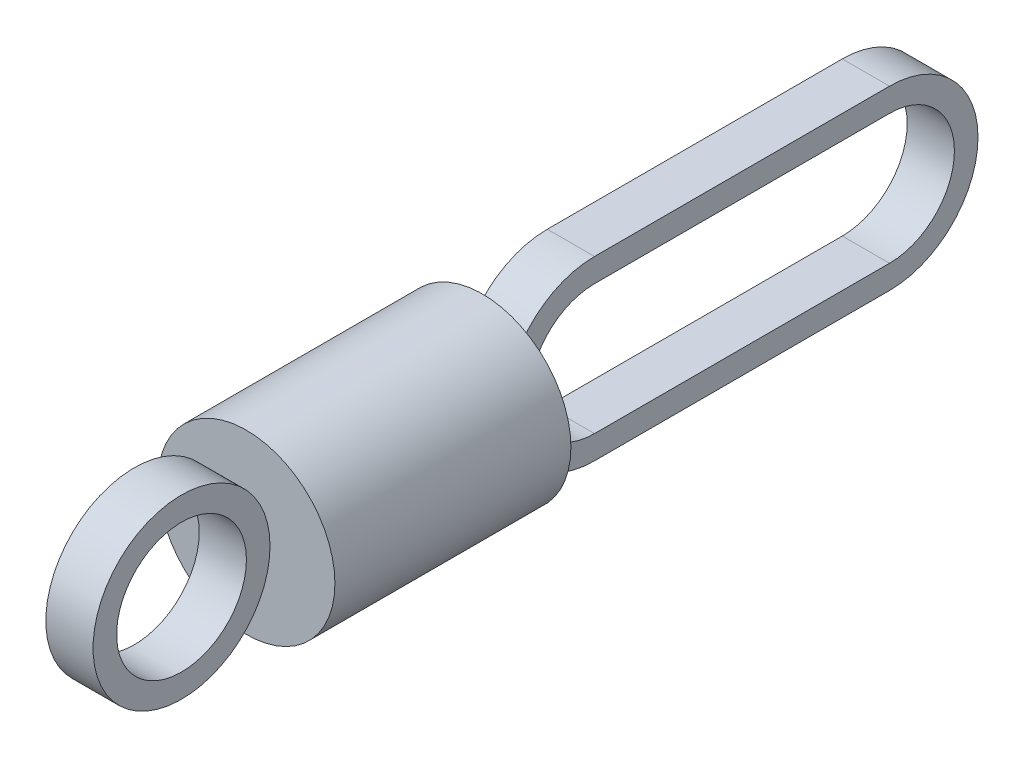
from build123d import *

# Parameters (mm, degrees)
BOSS_EXTRUDE1_DEPTH        = 0.8
BOSS_EXTRUDE1_DEPTH_BACK   = 0.8
SKETCH1_R                  = 3
BOSS_EXTRUDE1_2_DEPTH      = 0.8
BOSS_EXTRUDE1_2_DEPTH_BACK = 0.8
SKETCH2_R                  = 2.2
CUT_EXTRUDE1_DEPTH         = 1.6
SKETCH6_R                  = 3
BOSS_EXTRUDE3_DEPTH        = 8


with BuildPart() as part:
    # Sketch1 → Boss-Extrude1 (new, two sides: drawn at the far end of the back side and taken through both)
    with BuildSketch(Plane(origin=(0, 0, 0), x_dir=(0, 0, -1), z_dir=(1, 0, 0)).offset(-BOSS_EXTRUDE1_DEPTH_BACK)):
        Circle(SKETCH1_R)
    extrude(amount=BOSS_EXTRUDE1_DEPTH + BOSS_EXTRUDE1_DEPTH_BACK)


with BuildPart() as body_2:
    # Sketch1 → Boss-Extrude1 2 (new, two sides: drawn at the far end of the back side and taken through both)
    with BuildSketch(Plane(origin=(0, 0, 0), x_dir=(0, 0, -1), z_dir=(1, 0, 0)).offset(-BOSS_EXTRUDE1_2_DEPTH_BACK)):
        with BuildLine():
            Line((24, -3), (14, -3))
            ThreePointArc((14, -3), (11, 0), (14, 3))
            Line((14, 3), (24, 3))
            ThreePointArc((24, 3), (27, 0), (24, -3))
        make_face()
    extrude(amount=BOSS_EXTRUDE1_2_DEPTH + BOSS_EXTRUDE1_2_DEPTH_BACK)


with BuildPart() as cut_extrude1_tool:
    # Sketch2 → Cut-Extrude1 (new body)
    with BuildSketch(Plane(origin=(0.8, 0, 0), x_dir=(0, 0, -1), z_dir=(1, 0, 0))):
        Circle(SKETCH2_R)
        with BuildLine():
            Line((24, -2.2), (14, -2.2))
            ThreePointArc((14, -2.2), (11.8, 0), (14, 2.2))
            Line((14, 2.2), (24, 2.2))
            ThreePointArc((24, 2.2), (26.2, 0), (24, -2.2))
        make_face()
    extrude(amount=-CUT_EXTRUDE1_DEPTH)


with BuildPart() as part_1:
    add(part.part)

    # Cut-Extrude1: cut by cut_extrude1_tool
    add(cut_extrude1_tool.part, mode=Mode.SUBTRACT)


with BuildPart() as body_2_1:
    add(body_2.part)

    # Cut-Extrude1: cut by cut_extrude1_tool
    add(cut_extrude1_tool.part, mode=Mode.SUBTRACT)


with BuildPart() as body_3:
    # Sketch6 → Boss-Extrude3 (new body)
    with BuildSketch(Plane.XY.offset(-3)):
        Circle(SKETCH6_R)
    extrude(amount=-BOSS_EXTRUDE3_DEPTH)


solid = Compound([part_1.part, body_2_1.part, body_3.part])
